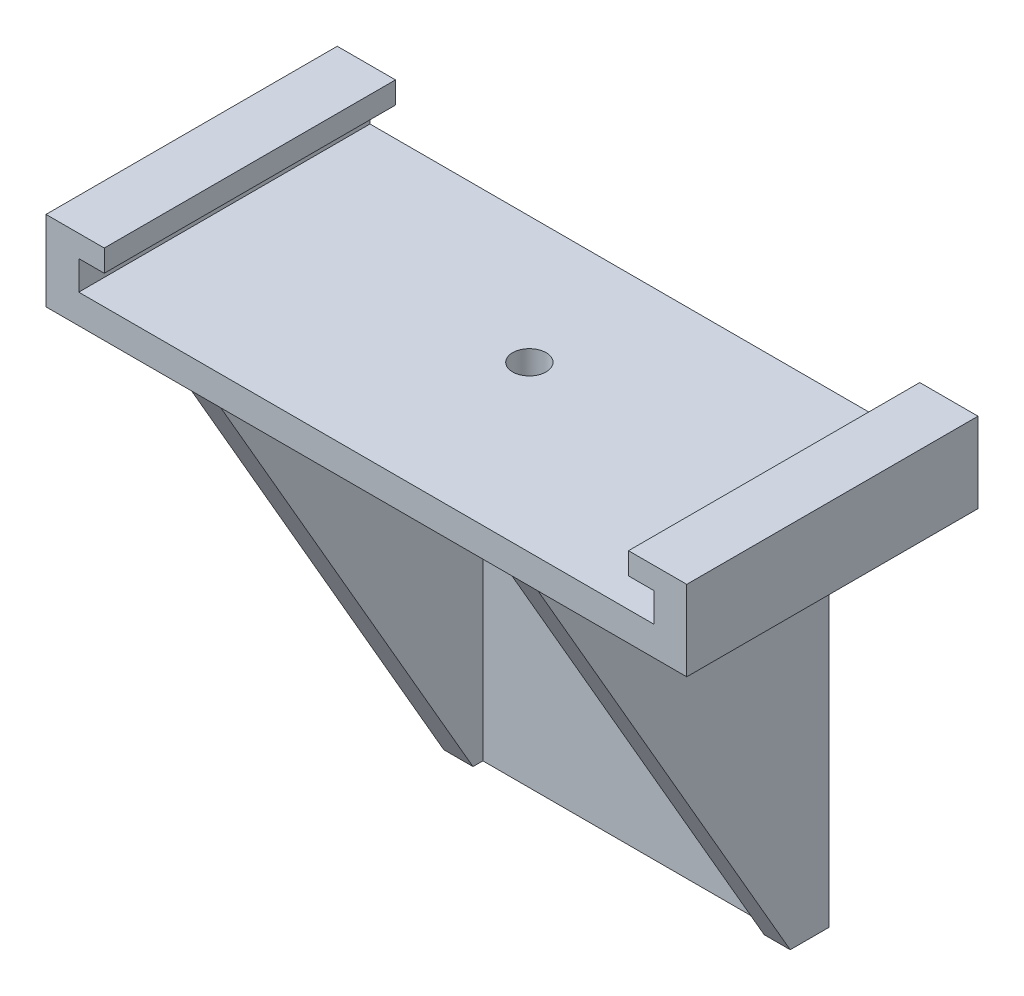
from build123d import *

# Parameters (mm, degrees)
SKETCH1_W           = 44
SKETCH1_H           = 20
BOSS_EXTRUDE1_DEPTH = 2
SKETCH2_W           = 2.25
SKETCH2_H           = 20
BOSS_EXTRUDE2_DEPTH = 2
SKETCH3_W           = 4
SKETCH3_H           = 20
BOSS_EXTRUDE3_DEPTH = 1.5
SKETCH7_W           = 20
SKETCH7_H           = 2
BOSS_EXTRUDE4_DEPTH = 30
CHAMFER1_SIZE       = 30
CHAMFER1_SIZE2      = 17.320508076
SKETCH8_R           = 1.15
CUT_EXTRUDE1_DEPTH  = 39.522720569


with BuildPart() as part:
    # Sketch1 → Boss-Extrude1 (new body)
    with BuildSketch(Plane(origin=(0, 0, 0), x_dir=(1, 0, 0), z_dir=(0, 1, 0))):
        Rectangle(SKETCH1_W, SKETCH1_H)
    extrude(amount=BOSS_EXTRUDE1_DEPTH)

    # Sketch2 → Boss-Extrude2 (add)
    with BuildSketch(Plane(origin=(0, 2, 0), x_dir=(1, 0, 0), z_dir=(0, 1, 0))):
        with Locations((-20.875, 0)):
            Rectangle(SKETCH2_W, SKETCH2_H)
        with Locations((20.875, 0)):
            Rectangle(SKETCH2_W, SKETCH2_H)
    extrude(amount=BOSS_EXTRUDE2_DEPTH)

    # Sketch3 → Boss-Extrude3 (add)
    with BuildSketch(Plane(origin=(0, 4, 0), x_dir=(1, 0, 0), z_dir=(0, 1, 0))):
        with Locations((-20, 0)):
            Rectangle(SKETCH3_W, SKETCH3_H)
        with Locations((20, 0)):
            Rectangle(SKETCH3_W, SKETCH3_H)
    extrude(amount=BOSS_EXTRUDE3_DEPTH)

    # Sketch7 → Boss-Extrude4 (add)
    with BuildSketch(Plane.XZ):
        Polygon((-12, -10), (-10, -10), (-10, -8), (-10, 10), (-12, 10), align=None)
        with Locations((0, -9)):
            Rectangle(SKETCH7_W, SKETCH7_H)
        Polygon((10, -8), (10, -10), (11.784691828, -10), (11.784691828, 10), (10, 10), align=None)
    extrude(amount=BOSS_EXTRUDE4_DEPTH)

    # Chamfer1
    chamfer1_edges = [part.edges().sort_by_distance(p)[0] for p in [
        (10.892345914, -30, 10),
        (-11, -30, 10),
    ]]
    chamfer1_side = [part.faces().sort_by_distance(p)[0] for p in [
        (-21.434646129, 2.75, 10),
    ]]
    chamfer(chamfer1_edges, length=CHAMFER1_SIZE, length2=CHAMFER1_SIZE2, reference=chamfer1_side[0])

    # Sketch8 → Cut-Extrude1 (cut, through all)
    with BuildSketch(Plane.XZ):
        with Locations(Location((-0.107654086, -1.3, 0), (0, 0, 270))):
            Circle(SKETCH8_R)
    extrude(amount=-CUT_EXTRUDE1_DEPTH, mode=Mode.SUBTRACT)


solid = part.part
